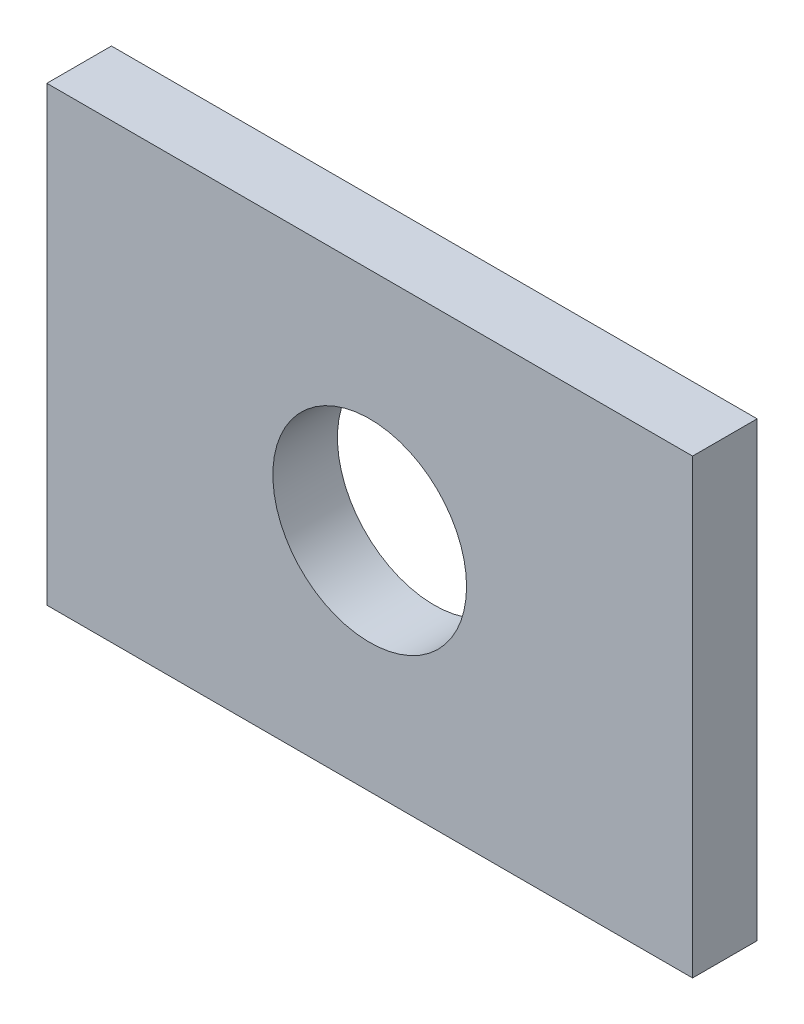
from build123d import *

# Parameters (mm, degrees)
SKETCH_1_W      = 10
SKETCH_1_H      = 7
SKETCH_1_R      = 1.5
EXTRUDE_1_DEPTH = 1


with BuildPart() as part:
    # 草图1 → 凸台-拉伸1 (new body)
    with BuildSketch(Plane.XY):
        Rectangle(SKETCH_1_W, SKETCH_1_H)
        Circle(SKETCH_1_R, mode=Mode.SUBTRACT)
    extrude(amount=EXTRUDE_1_DEPTH)


solid = part.part
